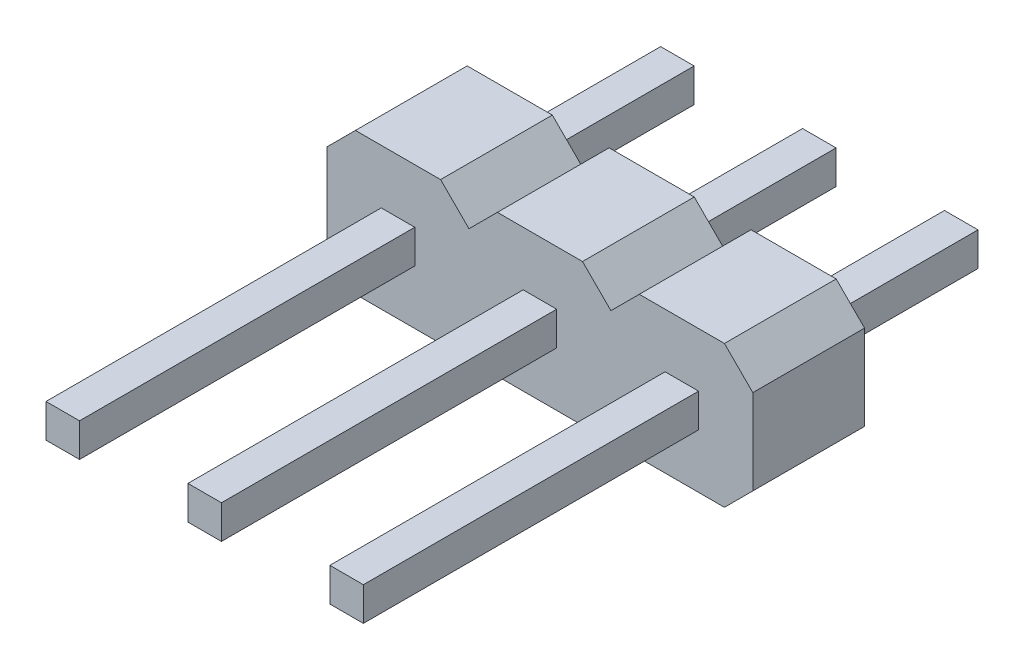
from build123d import *

# Parameters (mm, degrees)
SKETCH_1_W           = 0.6
SKETCH_1_H           = 0.6
EXTRUDE_1_DEPTH      = 2
EXTRUDE_2_DEPTH      = 6
EXTRUDE_2_DEPTH_BACK = 5
SKETCH_2_W           = 0.6
SKETCH_2_H           = 0.6


with BuildPart() as part:
    # 草图1 → 凸台-拉伸1 (new body)
    with BuildSketch(Plane.XY):
        Polygon((-0.762, 1.27), (-1.27, 0.762), (-1.27, -0.762), (-0.762, -1.27), (0.762, -1.27), (1.27, -0.762), (1.778, -1.27), (3.302, -1.27), (3.81, -0.762), (4.318, -1.27), (5.842, -1.27), (6.35, -0.762), (6.35, 0.762), (5.842, 1.27), (4.318, 1.27), (3.81, 0.762), (3.302, 1.27), (1.778, 1.27), (1.27, 0.762), (0.762, 1.27), align=None)
        with Locations((2.54, 0)):
            Rectangle(SKETCH_1_W, SKETCH_1_H, mode=Mode.SUBTRACT)
        Rectangle(SKETCH_1_W, SKETCH_1_H, mode=Mode.SUBTRACT)
        with Locations((5.08, 0)):
            Rectangle(SKETCH_1_W, SKETCH_1_H, mode=Mode.SUBTRACT)
    extrude(amount=EXTRUDE_1_DEPTH)

    # 草图2 → 凸台-拉伸2 (add, two sides: drawn at the far end of the back side and taken through both)
    with BuildSketch(Plane.XY.offset(2).offset(-EXTRUDE_2_DEPTH_BACK)):
        Rectangle(SKETCH_2_W, SKETCH_2_H)
        with Locations((2.54, 0)):
            Rectangle(SKETCH_2_W, SKETCH_2_H)
        with Locations((5.08, 0)):
            Rectangle(SKETCH_2_W, SKETCH_2_H)
    extrude(amount=EXTRUDE_2_DEPTH + EXTRUDE_2_DEPTH_BACK)


solid = part.part
